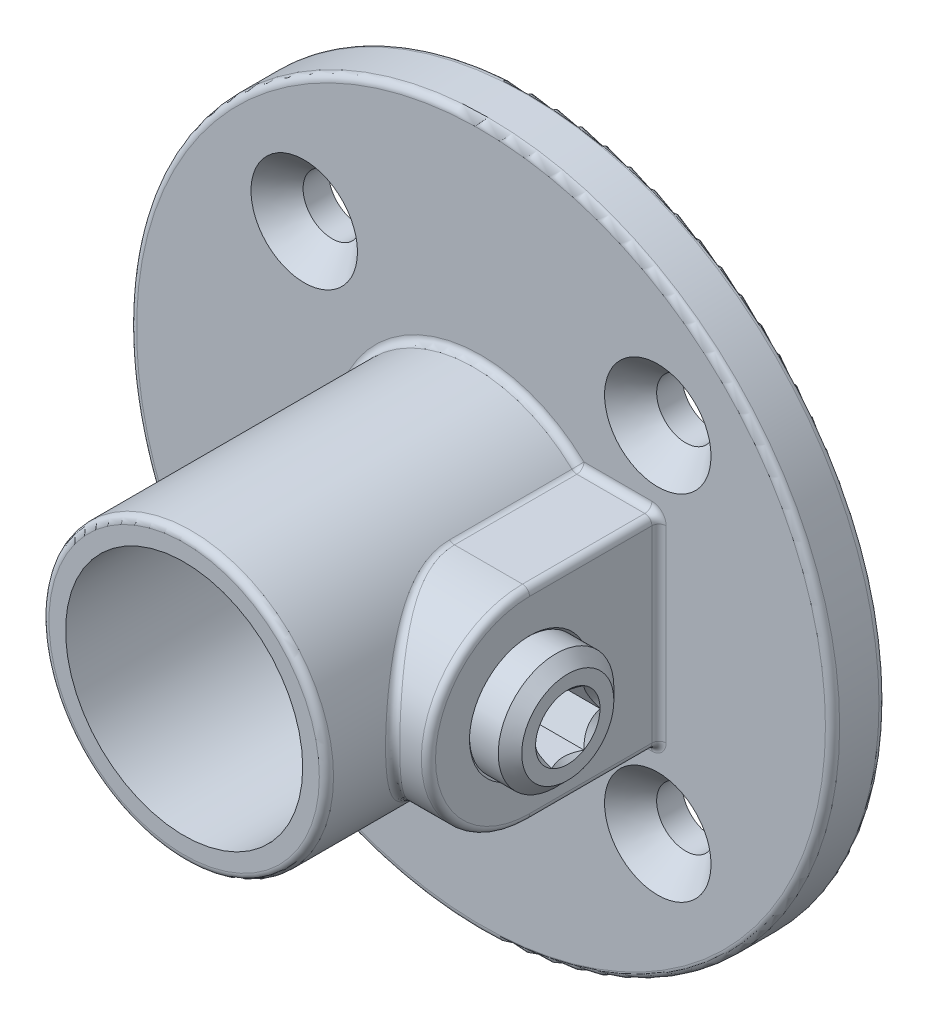
from build123d import *

# Parameters (mm, degrees)
SKETCH2_R                = 40.005
BOSS_EXTRUDE1_DEPTH      = 6.096
SKETCH3_R                = 16.1925
BOSS_EXTRUDE2_DEPTH      = 33.782
SKETCH4_R                = 13.49375
CUT_EXTRUDE1_DEPTH       = 36.83
SKETCH5_R                = 10.44575
CUT_EXTRUDE2_DEPTH       = 3.048
BOSS_EXTRUDE3_REACH      = 84.596
BOSS_EXTRUDE3_END_RADIUS = 16.1925
CUT_EXTRUDE3_REACH       = 84.596
CUT_EXTRUDE3_END_RADIUS  = 13.49375
SKETCH7_R                = 6.5786
CHAMFER1_SIZE            = 0.254
BOSS_EXTRUDE4_START      = -1.5875
SKETCH8_R                = 6.5786
BOSS_EXTRUDE4_DEPTH      = 12.7
CHAMFER2_SIZE            = 1.336842105
CUT_EXTRUDE4_DEPTH       = 12.7
SKETCH11_R               = 3.302
CUT_EXTRUDE6_DEPTH       = 6.096
FILLET1_R                = 0.809625


with BuildPart() as part:
    # Sketch2 → Boss-Extrude1 (new body)
    with BuildSketch(Plane.XY):
        with Locations(Location((0, 0, 0), (0, 0, 180))):
            Circle(SKETCH2_R)
    extrude(amount=BOSS_EXTRUDE1_DEPTH)

    # Sketch3 → Boss-Extrude2 (add)
    with BuildSketch(Plane.XY.offset(6.096)):
        Circle(SKETCH3_R)
    extrude(amount=BOSS_EXTRUDE2_DEPTH)

    # Sketch4 → Cut-Extrude1 (cut)
    with BuildSketch(Plane.XY.offset(39.878)):
        Circle(SKETCH4_R)
    extrude(amount=-CUT_EXTRUDE1_DEPTH, mode=Mode.SUBTRACT)

    # Sketch5 → Cut-Extrude2 (cut)
    with BuildSketch(Plane.XY.offset(3.048)):
        Circle(SKETCH5_R)
    extrude(amount=-CUT_EXTRUDE2_DEPTH, mode=Mode.SUBTRACT)

    # Boss-Extrude3: up to this cylinder (the profile starts outside it)
    boss_extrude3_end = Plane(origin=(0, 0, 18.12183), z_dir=(0, 0, -1)) * Cylinder(BOSS_EXTRUDE3_END_RADIUS, 202.577, mode=Mode.PRIVATE)
    # Sketch6 → Boss-Extrude3 (add, up to the surface)
    with BuildSketch(Plane(origin=(20.2565, 0, 0), x_dir=(0, 0, -1), z_dir=(1, 0, 0)), mode=Mode.PRIVATE) as boss_extrude3_sk1:
        with BuildLine():
            Line((-20.828, 11.51255), (-6.096, 11.51255))
            Line((-6.096, 11.51255), (-6.096, -11.51255))
            Line((-6.096, -11.51255), (-20.828, -11.51255))
            ThreePointArc((-20.828, -11.51255), (-32.34055, 0), (-20.828, 11.51255))
        make_face()
    boss_extrude3_tool1 = extrude(boss_extrude3_sk1.sketch, amount=-BOSS_EXTRUDE3_REACH, mode=Mode.PRIVATE) - boss_extrude3_end
    add(boss_extrude3_tool1.solids().sort_by_distance((20.2565, 0, 18.12183))[0])

    # Cut-Extrude3: up to this cylinder (the profile starts outside it)
    cut_extrude3_end = Plane(origin=(0, 0, 20.828), z_dir=(0, 0, 1)) * Cylinder(CUT_EXTRUDE3_END_RADIUS, 197.1795, mode=Mode.PRIVATE)
    # Sketch7 → Cut-Extrude3 (cut, up to the surface)
    with BuildSketch(Plane(origin=(20.2565, 0, 0), x_dir=(0, 0, -1), z_dir=(1, 0, 0)), mode=Mode.PRIVATE) as cut_extrude3_sk1:
        with Locations((-20.828, 0)):
            Circle(SKETCH7_R)
    cut_extrude3_tool1 = extrude(cut_extrude3_sk1.sketch, amount=-CUT_EXTRUDE3_REACH, mode=Mode.PRIVATE) - cut_extrude3_end
    add(cut_extrude3_tool1.solids().sort_by_distance((20.2565, 0, 20.828))[0], mode=Mode.SUBTRACT)

    # Chamfer1
    chamfer1_edges = [part.edges().sort_by_distance(p)[0] for p in [
        (20.2565, 0, 27.4066),
    ]]
    chamfer(chamfer1_edges, length=CHAMFER1_SIZE)

    # Sketch11 → Cut-Extrude6 (cut)
    with BuildSketch(Plane(origin=(0, 0, 0), x_dir=(-1, 0, 0), z_dir=(0, 0, -1))):
        with Locations((20.115773711, 20.115773711)):
            Circle(SKETCH11_R)
        with Locations((-20.115773711, 20.115773711)):
            Circle(SKETCH11_R)
        with Locations((20.115773711, -20.115773711)):
            Circle(SKETCH11_R)
        with Locations((-20.115773711, -20.115773711)):
            Circle(SKETCH11_R)
    extrude(amount=-CUT_EXTRUDE6_DEPTH, mode=Mode.SUBTRACT)

    # Cut-Extrude7 cone 1 section (through the dimple's axis) → Cut-Extrude7 (revolve, cut)
    with BuildSketch(Plane(origin=(-20.115773711, 20.115773711, 6.096), x_dir=(0, -1, 0), z_dir=(1, 0, 0))):
        Polygon((0, 0), (6.0579, 0), (0, 6.968816774), align=None)
    revolve(axis=Axis((-20.115773711, 20.115773711, 6.096), (0, 0, -1)), mode=Mode.SUBTRACT)

    # Cut-Extrude7 cone 2 section (through the dimple's axis) → Cut-Extrude7 cone 2 (revolve, cut)
    with BuildSketch(Plane(origin=(20.115773711, 20.115773711, 6.096), x_dir=(0, -1, 0), z_dir=(1, 0, 0))):
        Polygon((0, 0), (6.0579, 0), (0, 6.968816774), align=None)
    revolve(axis=Axis((20.115773711, 20.115773711, 6.096), (0, 0, -1)), mode=Mode.SUBTRACT)

    # Cut-Extrude7 cone 3 section (through the dimple's axis) → Cut-Extrude7 cone 3 (revolve, cut)
    with BuildSketch(Plane(origin=(20.115773711, -20.115773711, 6.096), x_dir=(0, -1, 0), z_dir=(1, 0, 0))):
        Polygon((0, 0), (6.0579, 0), (0, 6.968816774), align=None)
    revolve(axis=Axis((20.115773711, -20.115773711, 6.096), (0, 0, -1)), mode=Mode.SUBTRACT)

    # Cut-Extrude7 cone 4 section (through the dimple's axis) → Cut-Extrude7 cone 4 (revolve, cut)
    with BuildSketch(Plane(origin=(-20.115773711, -20.115773711, 6.096), x_dir=(0, -1, 0), z_dir=(1, 0, 0))):
        Polygon((0, 0), (6.0579, 0), (0, 6.968816774), align=None)
    revolve(axis=Axis((-20.115773711, -20.115773711, 6.096), (0, 0, -1)), mode=Mode.SUBTRACT)

    # Fillet1
    fillet1_edges = [part.edges().sort_by_distance(p)[0] for p in [
        (-13.49375, 0, 3.048),
        (-10.44575, 0, 0),
        (-10.44575, 0, 3.048),
        (40.005, 0, 0),
        (15.821628802, 11.51255, 6.096),
        (11.386757605, 11.51255, 13.462),
        (11.386757605, -11.51255, 13.462),
        (15.821628802, -11.51255, 6.096),
        (13.976547823, 8.176378596, 28.932667835),
        (20.2565, 0, 32.34055),
        (20.2565, -11.51255, 13.462),
        (20.2565, 0, 6.096),
        (20.2565, 11.51255, 13.462),
        (40.005, 0, 6.096),
        (-16.1925, 0, 6.096),
        (-16.1925, 0, 39.878),
    ]]
    fillet(fillet1_edges, radius=FILLET1_R)


with BuildPart() as body_2:
    # Sketch8 → Boss-Extrude4 (new body)
    with BuildSketch(Plane(origin=(13.49375, 0, 0), x_dir=(0, 0, -1), z_dir=(1, 0, 0)).offset(BOSS_EXTRUDE4_START)):
        with Locations((-20.828, 0)):
            Circle(SKETCH8_R)
    extrude(amount=BOSS_EXTRUDE4_DEPTH)

    # Chamfer2
    chamfer2_edges = [body_2.edges().sort_by_distance(p)[0] for p in [
        (11.90625, 0, 27.4066),
        (24.60625, 0, 27.4066),
    ]]
    chamfer(chamfer2_edges, length=CHAMFER2_SIZE)

    # Sketch9 → Cut-Extrude4 (cut)
    with BuildSketch(Plane(origin=(24.60625, 0, 0), x_dir=(0, 0, -1), z_dir=(1, 0, 0))):
        Polygon((-17.161825791, 0), (-18.994912895, 3.175), (-22.661087105, 3.175), (-24.494174209, 0), (-22.661087105, -3.175), (-18.994912895, -3.175), align=None)
    extrude(amount=-CUT_EXTRUDE4_DEPTH, mode=Mode.SUBTRACT)

    # Cut-Extrude5 cone 1 section (through the dimple's axis) → Cut-Extrude5 (revolve, cut)
    with BuildSketch(Plane(origin=(24.60625, 0, 20.828), x_dir=(0, 0, -1), z_dir=(0, 1, 0))):
        Polygon((0, 0), (3.666174209, 0), (0, 3.666174209), align=None)
    revolve(axis=Axis((24.60625, 0, 20.828), (-1, 0, 0)), mode=Mode.SUBTRACT)


solid = Compound([part.part, body_2.part])
